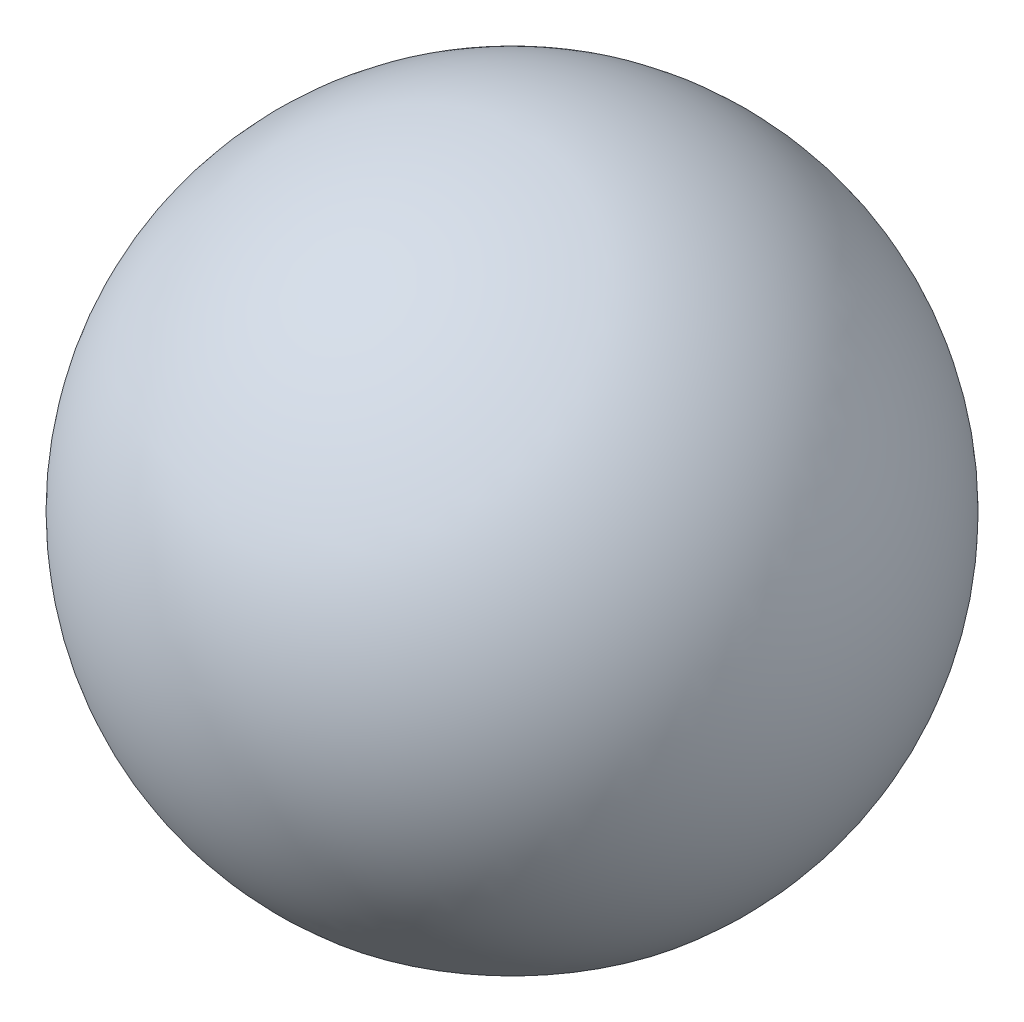
from build123d import *

# Parameters (mm, degrees)
ESQUISSE3_W             = 10.4
ESQUISSE3_H             = 7.9
ESQUISSE3_W_2           = 10
ESQUISSE3_H_2           = 7.5
ENL_V_MAT_EXTRU_1_DEPTH = 10
ESQUISSE5_W             = 20
ESQUISSE5_H             = 20
ENL_V_MAT_EXTRU_2_DEPTH = 3


with BuildPart() as part:
    # Esquisse2 → Révolution1 (revolve)
    with BuildSketch(Plane(origin=(0, 0, 0), x_dir=(0, 0, -1), z_dir=(1, 0, 0))):
        with BuildLine():
            Line((0, 0), (0, 25))
            ThreePointArc((0, 25), (12.5, 12.5), (0, 0))
        make_face()
    revolve(axis=Axis((0, 0, 0), (0, 1, 0)))

    # Esquisse3 → Enlèv. mat.-Extru.1 (cut)
    # profile 1 of 2: a face of its own
    with BuildSketch(Plane(origin=(0, 0, 0), x_dir=(1, 0, 0), z_dir=(0, 1, 0))):
        Rectangle(ESQUISSE3_W, ESQUISSE3_H)
        Rectangle(ESQUISSE3_W_2, ESQUISSE3_H_2, mode=Mode.SUBTRACT)
    # profile 2 of 2: a face of its own
    with BuildSketch(Plane(origin=(0, 0, 0), x_dir=(1, 0, 0), z_dir=(0, 1, 0))):
        Rectangle(ESQUISSE3_W_2, ESQUISSE3_H_2)
    extrude(amount=ENL_V_MAT_EXTRU_1_DEPTH, mode=Mode.SUBTRACT)

    # Esquisse5 → Enlèv. mat.-Extru.2 (cut)
    with BuildSketch(Plane(origin=(0, 0, 0), x_dir=(1, 0, 0), z_dir=(0, 1, 0))):
        Rectangle(ESQUISSE5_W, ESQUISSE5_H)
    extrude(amount=ENL_V_MAT_EXTRU_2_DEPTH, mode=Mode.SUBTRACT)


solid = part.part
